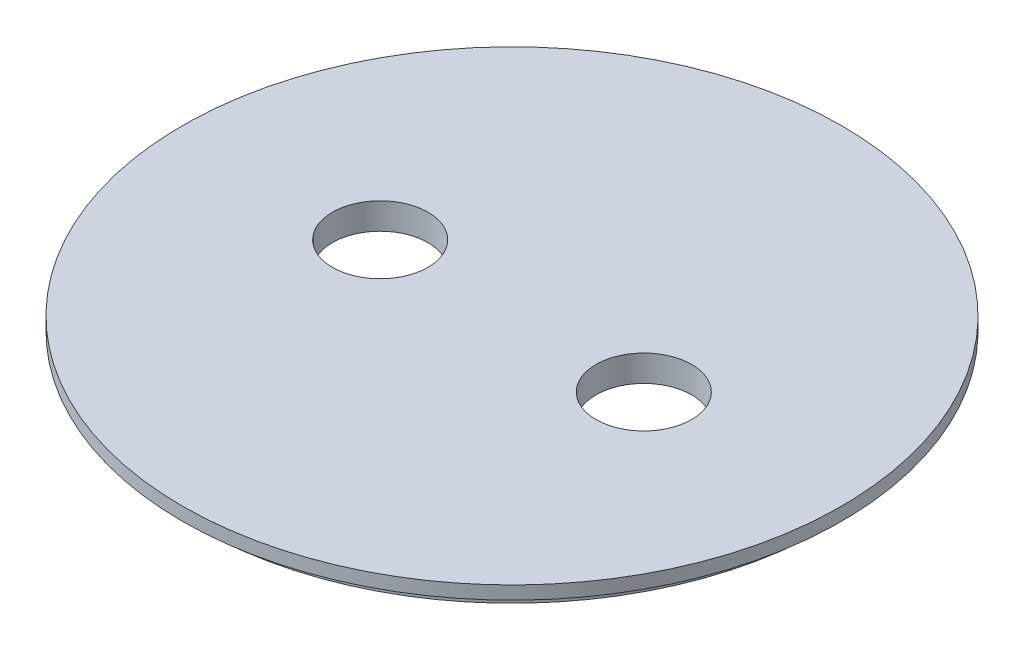
from build123d import *

# Parameters (mm, degrees)
SKETCH1_R           = 50
BOSS_EXTRUDE1_DEPTH = 2
SKETCH2_R           = 47.75
BOSS_EXTRUDE2_DEPTH = 2
SKETCH3_R           = 7.25
CUT_EXTRUDE1_DEPTH  = 71.823724839


with BuildPart() as part:
    # Sketch1 → Boss-Extrude1 (new body)
    with BuildSketch(Plane(origin=(0, 0, 0), x_dir=(1, 0, 0), z_dir=(0, 1, 0))):
        with Locations(Location((0, 0, 0), (0, 0, 270))):
            Circle(SKETCH1_R)
    extrude(amount=BOSS_EXTRUDE1_DEPTH)

    # Sketch2 → Boss-Extrude2 (add)
    with BuildSketch(Plane.XZ):
        with Locations(Location((0, 0, 0), (0, 0, 270))):
            Circle(SKETCH2_R)
    extrude(amount=BOSS_EXTRUDE2_DEPTH)

    # Sketch3 → Cut-Extrude1 (cut, through all)
    with BuildSketch(Plane(origin=(0, 2, 0), x_dir=(1, 0, 0), z_dir=(0, 1, 0))):
        with Locations(Location((-20, 0, 0), (0, 0, 270))):
            Circle(SKETCH3_R)
        with Locations(Location((20, 0, 0), (0, 0, 270))):
            Circle(SKETCH3_R)
    extrude(amount=-CUT_EXTRUDE1_DEPTH, mode=Mode.SUBTRACT)


solid = part.part
